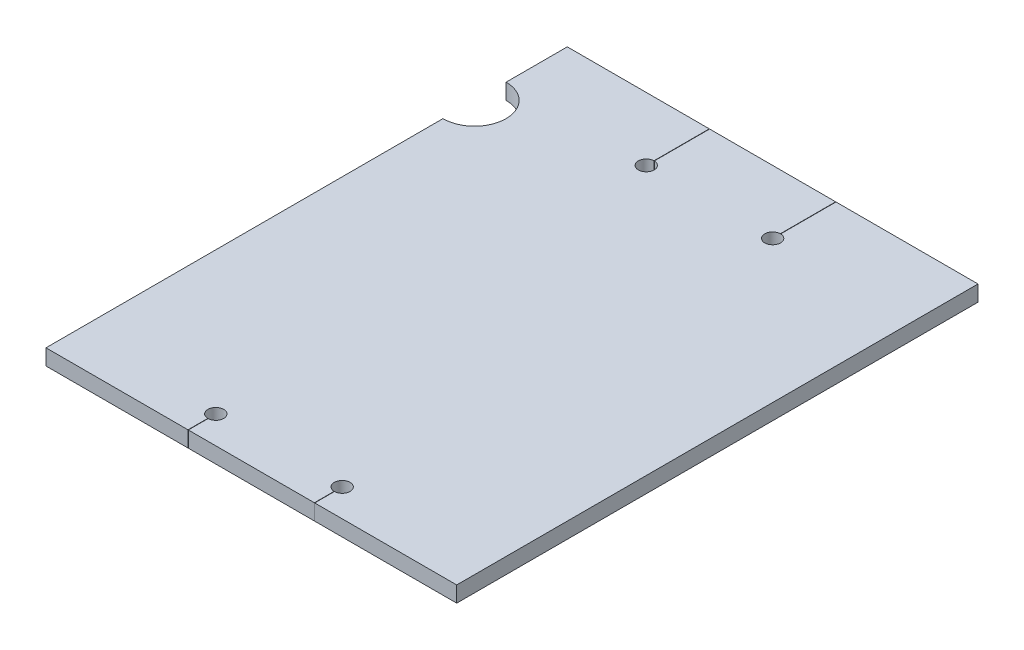
from build123d import *

# Parameters (mm, degrees)
SKETCH2_W          = 330.2
SKETCH2_H          = 431.8
EXTRUDE2_DEPTH     = 12.7
SKETCH3_W          = 463.121935294
SKETCH3_H          = 86.735895098
CUT_EXTRUDE1_DEPTH = 487.262418865
SKETCH4_R          = 25.4
CUT_EXTRUDE2_DEPTH = 487.262418865
CUT_EXTRUDE3_DEPTH = 487.262418865


with BuildPart() as part:
    # Sketch2 → Extrude2 (new body)
    with BuildSketch(Plane(origin=(0, 0, 0), x_dir=(1, 0, 0), z_dir=(0, 1, 0))):
        with Locations((0, 241.3)):
            Rectangle(SKETCH2_W, SKETCH2_H)
    extrude(amount=EXTRUDE2_DEPTH)

    # Sketch3 → Cut-Extrude1 (cut, through all)
    with BuildSketch(Plane(origin=(0, 0, 0), x_dir=(1, 0, 0), z_dir=(0, 1, 0))):
        with Locations((0, -5.267947549)):
            Rectangle(SKETCH3_W, SKETCH3_H)
    extrude(amount=CUT_EXTRUDE1_DEPTH, mode=Mode.SUBTRACT)

    # Sketch4 → Cut-Extrude2 (cut, through all)
    with BuildSketch(Plane(origin=(0, 0, 0), x_dir=(1, 0, 0), z_dir=(0, 1, 0))):
        with Locations((-165.1, 382.6002)):
            Circle(SKETCH4_R)
    extrude(amount=CUT_EXTRUDE2_DEPTH, mode=Mode.SUBTRACT)

    # Sketch5 → Cut-Extrude3 (cut, through all)
    with BuildSketch(Plane(origin=(0, 0, 0), x_dir=(1, 0, 0), z_dir=(0, 1, 0))):
        with BuildLine():
            Line((-50.927, 495.604822125), (-50.673, 495.604822125))
            Line((-50.673, 495.604822125), (-50.673, 412.748729873))
            ThreePointArc((-50.673, 412.748729873), (-50.8, 400.05), (-50.927, 412.748729873))
            Line((-50.927, 412.748729873), (-50.927, 495.604822125))
        make_face()
        with BuildLine():
            Line((50.673, 497.366900496), (50.927, 497.366900496))
            Line((50.927, 497.366900496), (50.927, 412.748729873))
            ThreePointArc((50.927, 412.748729873), (50.8, 400.05), (50.673, 412.748729873))
            Line((50.673, 412.748729873), (50.673, 497.366900496))
        make_face()
        with BuildLine():
            Line((-50.673, 53.976270127), (-50.673, 30.44578085))
            Line((-50.673, 30.44578085), (-50.927, 30.44578085))
            Line((-50.927, 30.44578085), (-50.927, 53.976270127))
            ThreePointArc((-50.927, 53.976270127), (-50.8, 66.675), (-50.673, 53.976270127))
        make_face()
        with BuildLine():
            Line((50.927, 53.976270127), (50.927, 31.394028455))
            Line((50.927, 31.394028455), (50.673, 31.394028455))
            Line((50.673, 31.394028455), (50.673, 53.976270127))
            ThreePointArc((50.673, 53.976270127), (50.8, 66.675), (50.927, 53.976270127))
        make_face()
    extrude(amount=CUT_EXTRUDE3_DEPTH, mode=Mode.SUBTRACT)


solid = part.part
